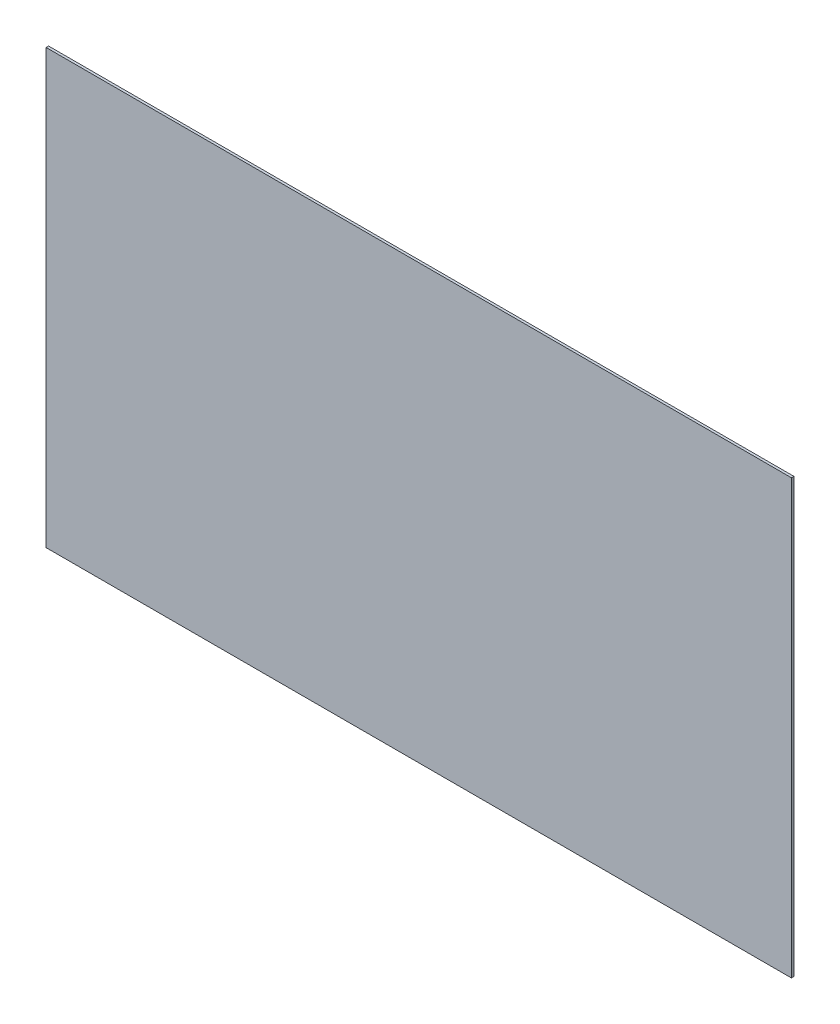
from build123d import *

# Parameters (mm, degrees)
SKETCH1_W           = 1201
SKETCH1_H           = 698
BOSS_EXTRUDE1_DEPTH = 4


with BuildPart() as part:
    # Sketch1 → Boss-Extrude1 (new body)
    with BuildSketch(Plane.XY):
        Rectangle(SKETCH1_W, SKETCH1_H)
    extrude(amount=BOSS_EXTRUDE1_DEPTH)


solid = part.part
